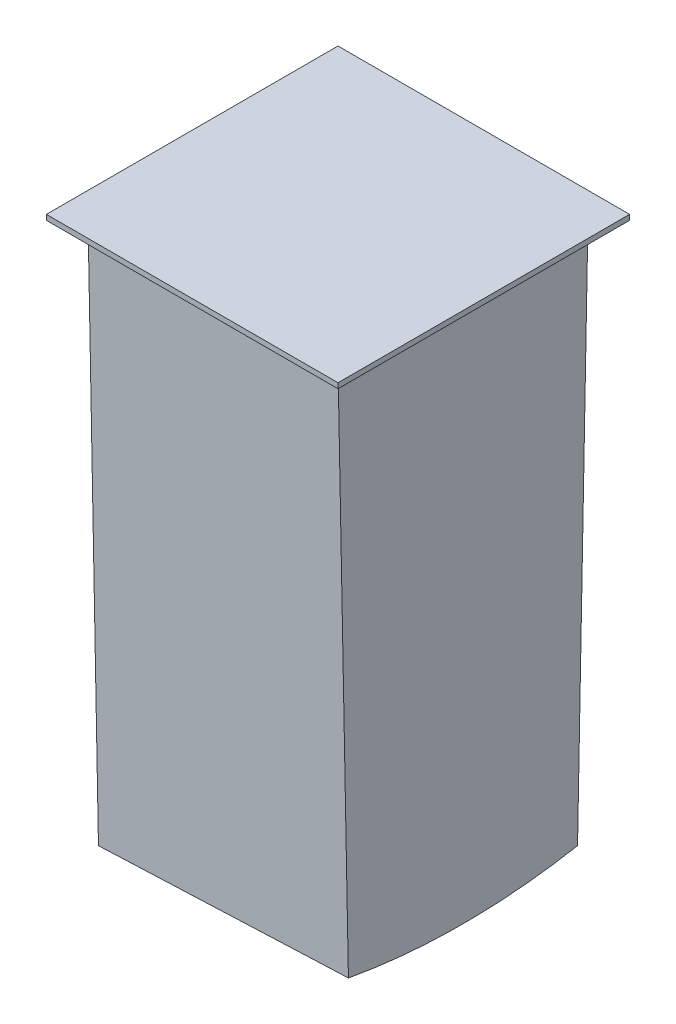
from build123d import *

# Parameters (mm, degrees)
SKETCH9_W = 355.6
SKETCH9_H = 355.6
LID_DEPTH = 6.35


with BuildPart() as part:
    # Tall side for Body → Body section 0
    with BuildSketch(Plane(origin=(0, 0, 0), x_dir=(0, 0, -1), z_dir=(1, 0, 0))):
        with BuildLine():
            Line((640.712288406, 673.594571301), (335.912288406, 673.594571301))
            Line((335.912288406, 673.594571301), (348.612288406, 6.844571301))
            # circular arc as an exact rational Bezier (weights 1, cos(half-angle), 1)
            Bezier((348.612288406, 6.844571301), (488.312288406, -45.692180835), (628.012288406, 6.844571301), weights=[1, 0.936, 1])
            Line((628.012288406, 6.844571301), (640.712288406, 673.594571301))
        make_face()
    # Short side for Body → Body section 1
    with BuildSketch(Plane(origin=(304.8, 0, 0), x_dir=(0, 0, -1), z_dir=(1, 0, 0))):
        with BuildLine():
            Line((640.716339838, 673.594571301), (335.916339838, 673.594571301))
            Line((335.916339838, 673.594571301), (348.616339838, 19.544571301))
            Bezier((348.616339838, 19.544571301), (488.316339838, -6.067095365), (628.016339838, 19.544571301), weights=[1, 0.983606557, 1])
            Line((628.016339838, 19.544571301), (640.716339838, 673.594571301))
        make_face()
    loft()

    # Sketch9 → Lid (add)
    with BuildSketch(Plane(origin=(0, 673.594571301, 0), x_dir=(1, 0, 0), z_dir=(0, 1, 0))):
        with Locations((152.4, 488.314314122)):
            Rectangle(SKETCH9_W, SKETCH9_H)
    extrude(amount=LID_DEPTH)


solid = part.part
